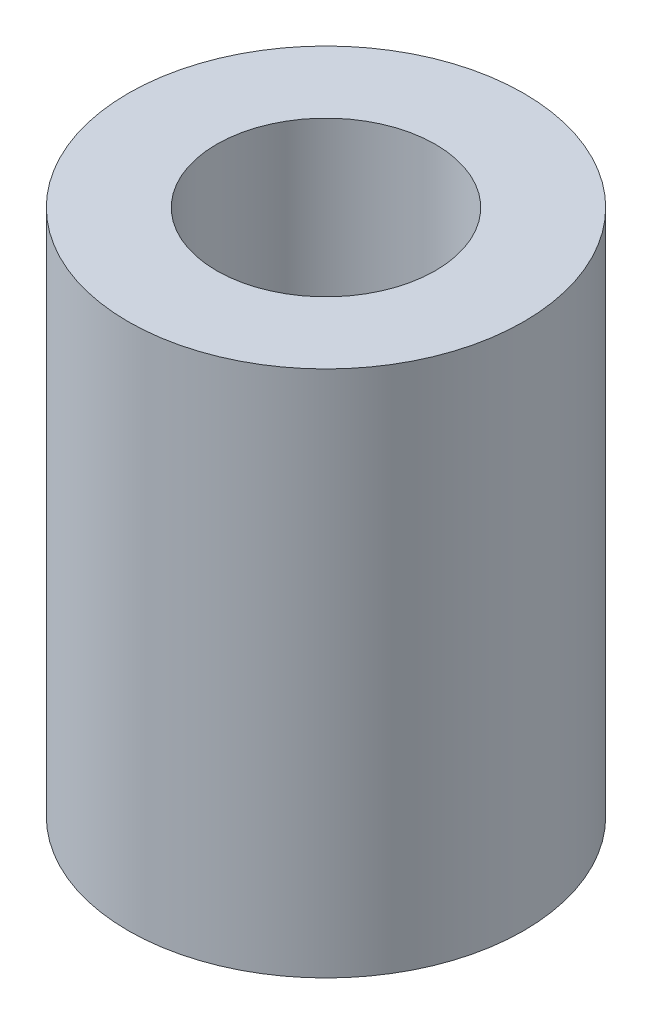
from build123d import *

# Parameters (mm, degrees)
SKETCH_1_R      = 7.5
SKETCH_1_R_2    = 4.15
EXTRUDE_1_DEPTH = 20


with BuildPart() as part:
    # 草图1 → 凸台-拉伸1 (new body)
    with BuildSketch(Plane(origin=(0, 0, 0), x_dir=(1, 0, 0), z_dir=(0, 1, 0))):
        with Locations(Location((0, 0, 0), (0, 0, 270))):
            Circle(SKETCH_1_R)
        with Locations(Location((0, 0, 0), (0, 0, 270))):
            Circle(SKETCH_1_R_2, mode=Mode.SUBTRACT)
    extrude(amount=EXTRUDE_1_DEPTH)


solid = part.part
